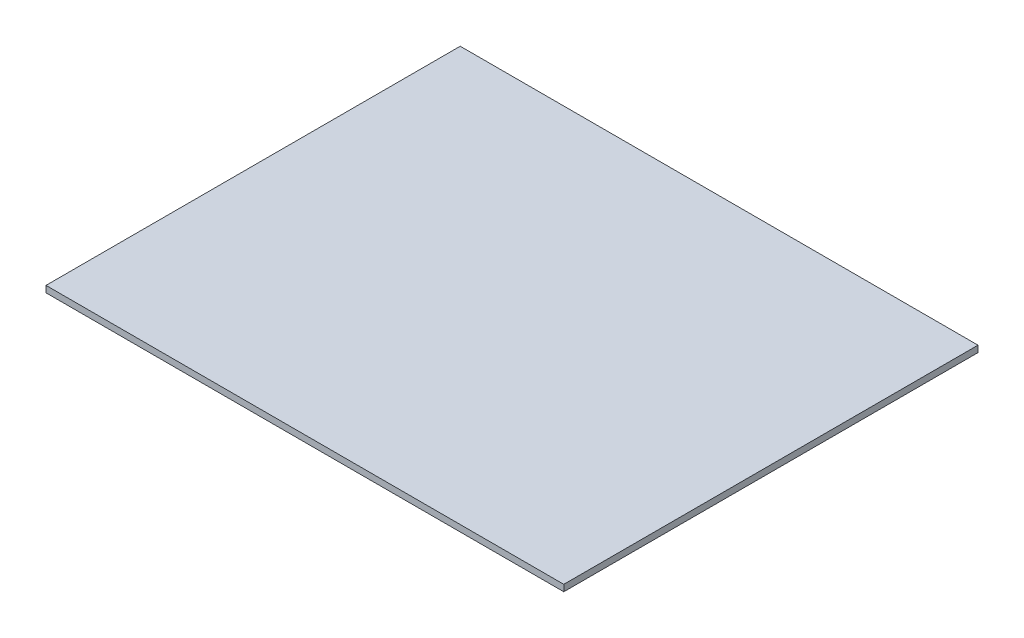
from build123d import *

# Parameters (mm, degrees)
SKETCH1_W           = 254
SKETCH1_H           = 203.2
BOSS_EXTRUDE1_DEPTH = 3.175


with BuildPart() as part:
    # Sketch1 → Boss-Extrude1 (new body)
    with BuildSketch(Plane(origin=(0, 0, 0), x_dir=(1, 0, 0), z_dir=(0, 1, 0))):
        with Locations((127, 101.6)):
            Rectangle(SKETCH1_W, SKETCH1_H)
    extrude(amount=BOSS_EXTRUDE1_DEPTH)


solid = part.part
